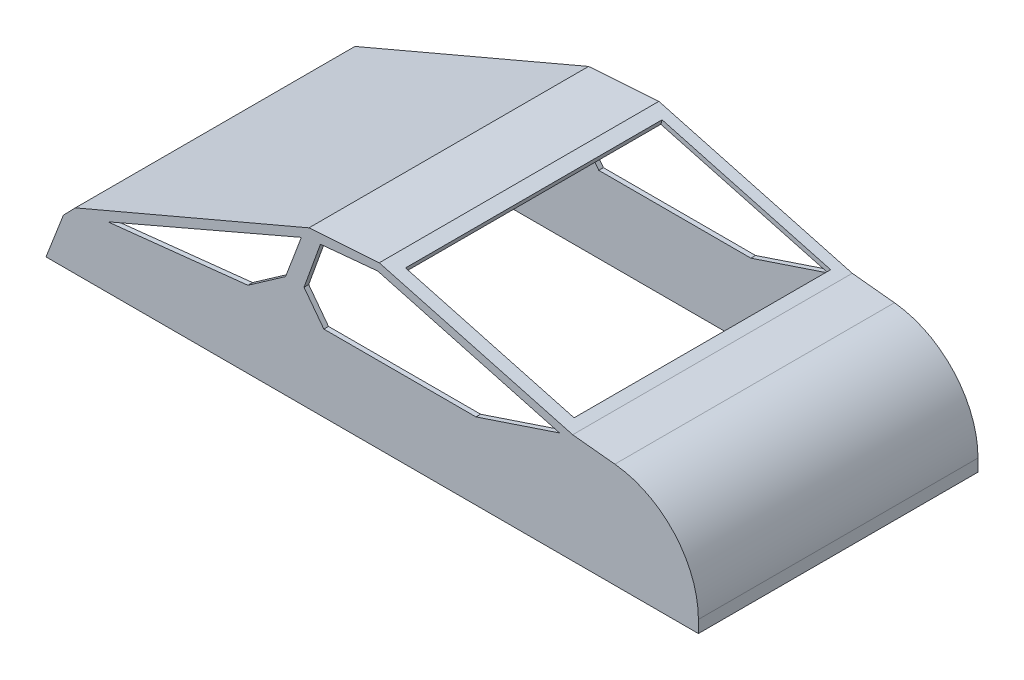
from build123d import *

# Parameters (mm, degrees)
EXTRUDE_1_DEPTH     = 300
SHELL_2_T           = -5
CUT_EXTRUDE_1_DEPTH = 300
SKETCH_4_W          = 187.367155343
SKETCH_4_H          = 275.26588877
CUT_EXTRUDE_2_DEPTH = 10


with BuildPart() as part:
    # 草图1 → 凸台-拉伸1 (new body)
    with BuildSketch(Plane.XY):
        with BuildLine():
            Line((-402.186878728, -155.168986083), (297.813121272, -155.168986083))
            Line((297.813121272, -155.168986083), (297.813121272, -142.016461596))
            ThreePointArc((297.813121272, -142.016461596), (272.093642568, -75.065702407), (208.165038153, -42.553715721))
            Line((208.165038153, -42.553715721), (162.925157805, -37.845224347))
            Line((162.925157805, -37.845224347), (-44.606277086, 18.180372145))
            Line((-44.606277086, 18.180372145), (-120.025544077, 12.932974824))
            Line((-120.025544077, 12.932974824), (-370.712436241, -93.826427202))
            Line((-370.712436241, -93.826427202), (-383.529193777, -107.067800556))
            Line((-383.529193777, -107.067800556), (-402.186878728, -155.168986083))
        make_face()
    extrude(amount=EXTRUDE_1_DEPTH)

    # 抽壳2
    shell_2_openings = [part.faces().sort_by_distance(p)[0] for p in [
        (-52.186878728, -155.168986083, 150),
    ]]
    offset(amount=SHELL_2_T, openings=shell_2_openings, kind=Kind.INTERSECTION)

    # 草图3 → 切除-拉伸1 (cut)
    with BuildSketch(Plane(origin=(0, 0, 0), x_dir=(-1, 0, 0), z_dir=(0, 0, -1))):
        Polygon((145.146298651, -44.9212837), (128.165102127, 0), (335.819907539, -89.355551576), (185.513355718, -73.15629574), align=None)
        Polygon((107.735938101, 3.900733264), (125.333088077, -44.9212837), (104.080540111, -73.15629574), (-59.15944036, -73.15629574), (-148.825386801, -43.221714567), (46.237805698, 9.665692949), align=None)
    extrude(amount=-CUT_EXTRUDE_1_DEPTH, mode=Mode.SUBTRACT)

    # 草图4 → 切除-拉伸2 (cut)
    with BuildSketch(Plane(origin=(1.544560656, 5.721400739, 0), x_dir=(0.9654383198530997, -0.26063163767897407, 0), z_dir=(0.26063163767897407, 0.9654383198530997, 0))):
        with Locations((61.249747997, -149.050418092)):
            Rectangle(SKETCH_4_W, SKETCH_4_H)
    extrude(amount=-CUT_EXTRUDE_2_DEPTH, mode=Mode.SUBTRACT)


solid = part.part
